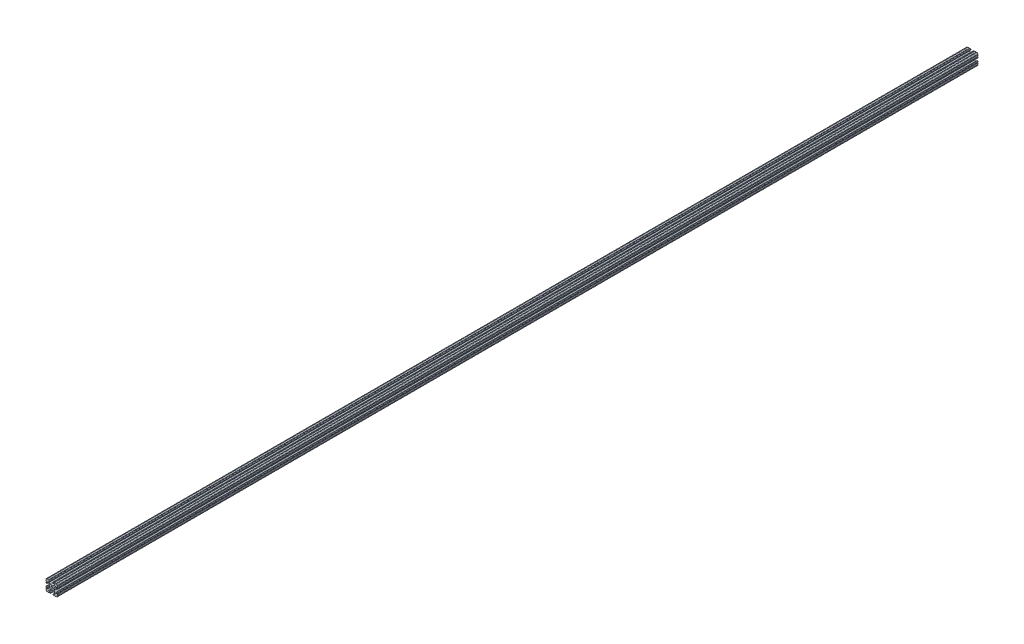
from build123d import *

# Parameters (mm, degrees)
BOSS_EXTRUDE1_DEPTH     = 1524
CUT_EXTRUDE1_DEPTH      = 1525.238106399
CUT_EXTRUDE1_DEPTH_BACK = 1525.238106399
SKETCH5_R               = 1.016


with BuildPart() as part:
    # Sketch4 → Boss-Extrude1 (new, symmetric)
    with BuildSketch(Plane.XY):
        with BuildLine():
            Line((5.7912, -19.05), (14.3002, -19.05))
            ThreePointArc((14.3002, -19.05), (17.658815789, -17.658815789), (19.05, -14.3002))
            Line((19.05, -14.3002), (19.05, -5.7912))
            ThreePointArc((19.05, -5.7912), (18.544114832, -4.569885168), (17.3228, -4.064))
            Line((17.3228, -4.064), (16.7132, -4.064))
            ThreePointArc((16.7132, -4.064), (15.491885168, -4.569885168), (14.986, -5.7912))
            Line((14.986, -5.7912), (14.986, -8.996305235))
            ThreePointArc((14.986, -8.996305235), (14.189232738, -10.188751711), (12.782646215, -9.908964256))
            Line((12.782646215, -9.908964256), (7.888897763, -5.015215804))
            ThreePointArc((7.888897763, -5.015215804), (7.219915375, -4.014012907), (6.985, -2.833013566))
            Line((6.985, -2.833013566), (6.985, 0))
            Line((6.985, 0), (3.3274, 0))
            ThreePointArc((3.3274, 0), (2.352827104, -2.352827104), (0, -3.3274))
            Line((0, -3.3274), (0, -6.985))
            Line((0, -6.985), (2.833013566, -6.985))
            ThreePointArc((2.833013566, -6.985), (4.014012907, -7.219915375), (5.015215804, -7.888897763))
            Line((5.015215804, -7.888897763), (9.908964256, -12.782646215))
            ThreePointArc((9.908964256, -12.782646215), (10.188751711, -14.189232738), (8.996305235, -14.986))
            Line((8.996305235, -14.986), (5.7912, -14.986))
            ThreePointArc((5.7912, -14.986), (4.569885168, -15.491885168), (4.064, -16.7132))
            Line((4.064, -16.7132), (4.064, -17.3228))
            ThreePointArc((4.064, -17.3228), (4.569885168, -18.544114832), (5.7912, -19.05))
        make_face()
    extrude(amount=BOSS_EXTRUDE1_DEPTH, both=True)

    # Sketch5 → Cut-Extrude1 (cut, two sides: drawn at the far end of the back side and taken through both)
    with BuildSketch(Plane.XY.offset(-CUT_EXTRUDE1_DEPTH_BACK)):
        with Locations((14.739477062, -19.05)):
            Circle(SKETCH5_R)
        with Locations((7.980305235, -19.05)):
            Circle(SKETCH5_R)
        with Locations((19.05, -14.739477062)):
            Circle(SKETCH5_R)
        with Locations((19.05, -7.980305235)):
            Circle(SKETCH5_R)
    extrude(amount=CUT_EXTRUDE1_DEPTH + CUT_EXTRUDE1_DEPTH_BACK, mode=Mode.SUBTRACT)

    # Mirror1: part across plane


with BuildPart() as part_1:
    add(part.part)
    add(part.part.mirror(Plane(origin=(0, 0, 0), x_dir=(0, 0, 1), z_dir=(1, 0, 0))))

    # Mirror2: part across plane


with BuildPart() as part_2:
    add(part_1.part)
    add(part_1.part.mirror(Plane.ZX))


solid = part_2.part
